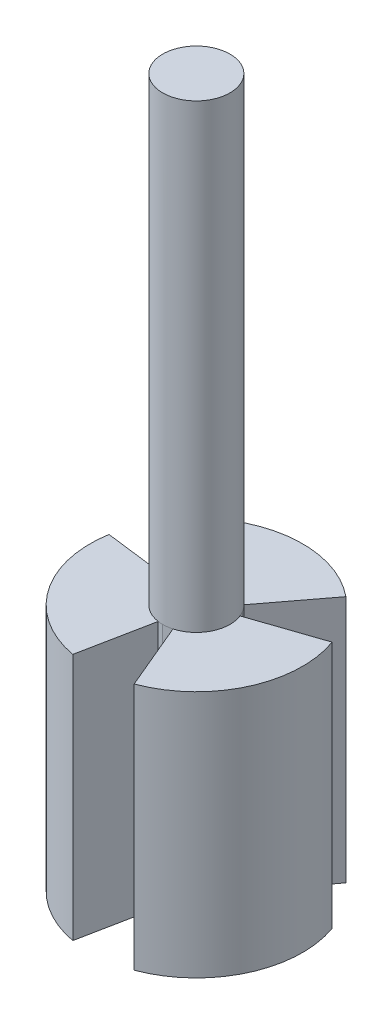
from build123d import *

# Parameters (mm, degrees)
SKETCH1_R           = 9.5
BOSS_EXTRUDE1_DEPTH = 200
SKETCH2_R           = 30
SKETCH2_R_2         = 9.5
BOSS_EXTRUDE2_DEPTH = 70
CUT_EXTRUDE1_DEPTH  = 137.747943312
CIRPATTERN1_COUNT   = 3


with BuildPart() as part:
    # Sketch1 → Boss-Extrude1 (new body)
    with BuildSketch(Plane(origin=(0, 0, 0), x_dir=(1, 0, 0), z_dir=(0, 1, 0))):
        with Locations(Location((0, 0, 0), (0, 0, 270))):
            Circle(SKETCH1_R)
    extrude(amount=BOSS_EXTRUDE1_DEPTH)

    # Sketch2 → Boss-Extrude2 (add)
    with BuildSketch(Plane.XZ):
        with Locations(Location((0, 0, 0), (0, 0, 270))):
            Circle(SKETCH2_R)
        with Locations(Location((0, 0, 0), (0, 0, 270))):
            Circle(SKETCH2_R_2, mode=Mode.SUBTRACT)
    extrude(amount=-BOSS_EXTRUDE2_DEPTH)

    # Sketch3 → Cut-Extrude1 (cut, through all)
    with BuildSketch(Plane(origin=(0, 70, 0), x_dir=(1, 0, 0), z_dir=(0, 1, 0))):
        Polygon((-5.921460856, -32.258084995), (-1.382914739, -9.398805606), (0, -9.5), (2.553944051, -9.150266104), (12.286259273, -32.258084995), align=None)
    cut_extrude1 = extrude(amount=-CUT_EXTRUDE1_DEPTH, mode=Mode.SUBTRACT)

    # CirPattern1: Cut-Extrude1 ×3 about axis
    cirpattern1_axis = Axis((0, 0, 0), (0, 1, 0))
    for i in range(1, CIRPATTERN1_COUNT):
        add(cut_extrude1.rotate(cirpattern1_axis, i * 360 / CIRPATTERN1_COUNT), mode=Mode.SUBTRACT)


solid = part.part
